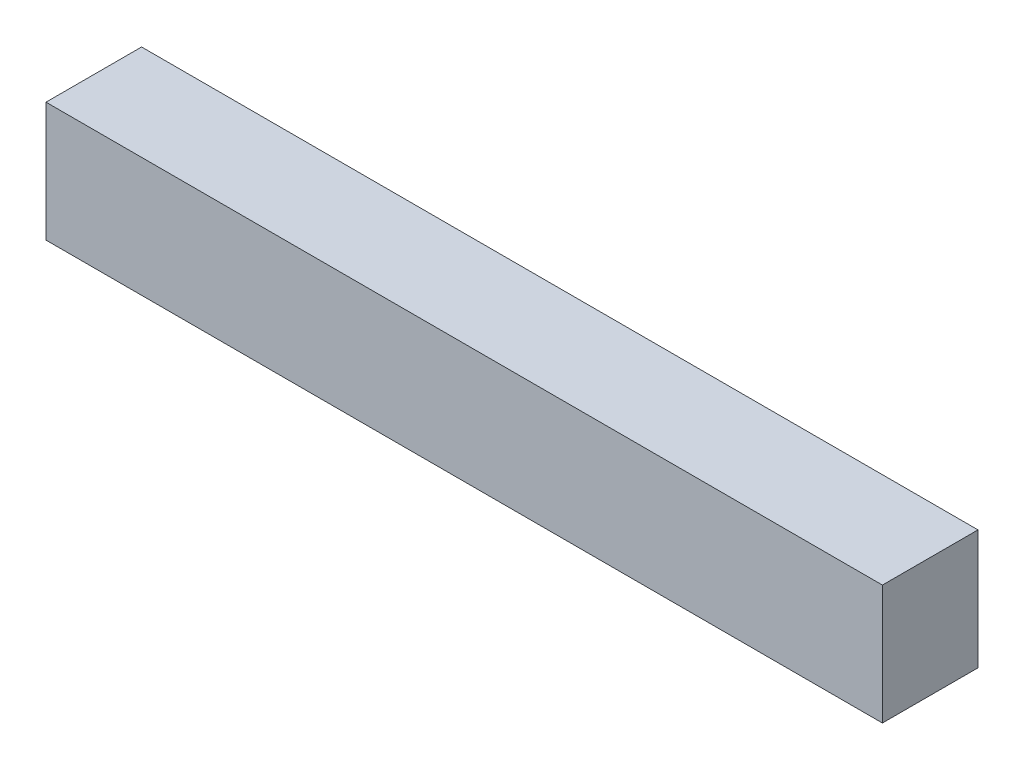
from build123d import *

# Parameters (mm, degrees)
SKETCH1_W           = 35
SKETCH1_H           = 4
BOSS_EXTRUDE1_DEPTH = 5


with BuildPart() as part:
    # Sketch1 → Boss-Extrude1 (new body)
    with BuildSketch(Plane(origin=(0, 0, 0), x_dir=(1, 0, 0), z_dir=(0, 1, 0))):
        Rectangle(SKETCH1_W, SKETCH1_H)
    extrude(amount=BOSS_EXTRUDE1_DEPTH)


solid = part.part
